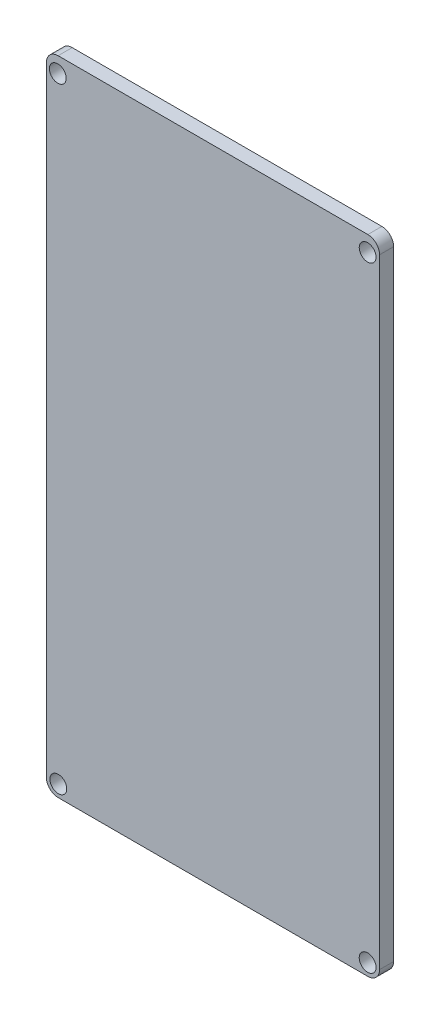
from build123d import *

# Parameters (mm, degrees)
ESQUISSE2_R        = 1.796051863
ESQUISSE2_R_2      = 1.796074603
BOSS_EXTRU_1_DEPTH = 3


with BuildPart() as part:
    # Esquisse2 → Boss.-Extru.1 (new body)
    with BuildSketch(Plane.XY):
        with BuildLine():
            Line((62.825, -226.383779), (128.945, -226.383779))
            ThreePointArc((128.945, -226.383779), (130.712766953, -225.651545953), (131.445, -223.883779))
            Line((131.445, -223.883779), (131.445, -91.723779))
            ThreePointArc((131.445, -91.723779), (130.712766953, -89.956012047), (128.945, -89.223779))
            Line((128.945, -89.223779), (62.825, -89.223779))
            ThreePointArc((62.825, -89.223779), (61.057233047, -89.956012047), (60.325, -91.723779))
            Line((60.325, -91.723779), (60.325, -223.883779))
            ThreePointArc((60.325, -223.883779), (61.057233047, -225.651545953), (62.825, -226.383779))
        make_face()
        with Locations((128.905, -223.8437785)):
            Circle(ESQUISSE2_R, mode=Mode.SUBTRACT)
        with Locations((62.872827217, -223.848297546)):
            Circle(ESQUISSE2_R_2, mode=Mode.SUBTRACT)
        with Locations((62.756034, -92.5438125)):
            Circle(ESQUISSE2_R, mode=Mode.SUBTRACT)
        with Locations((128.905000137, -92.543812421)):
            Circle(ESQUISSE2_R, mode=Mode.SUBTRACT)
    extrude(amount=-BOSS_EXTRU_1_DEPTH)


solid = part.part
